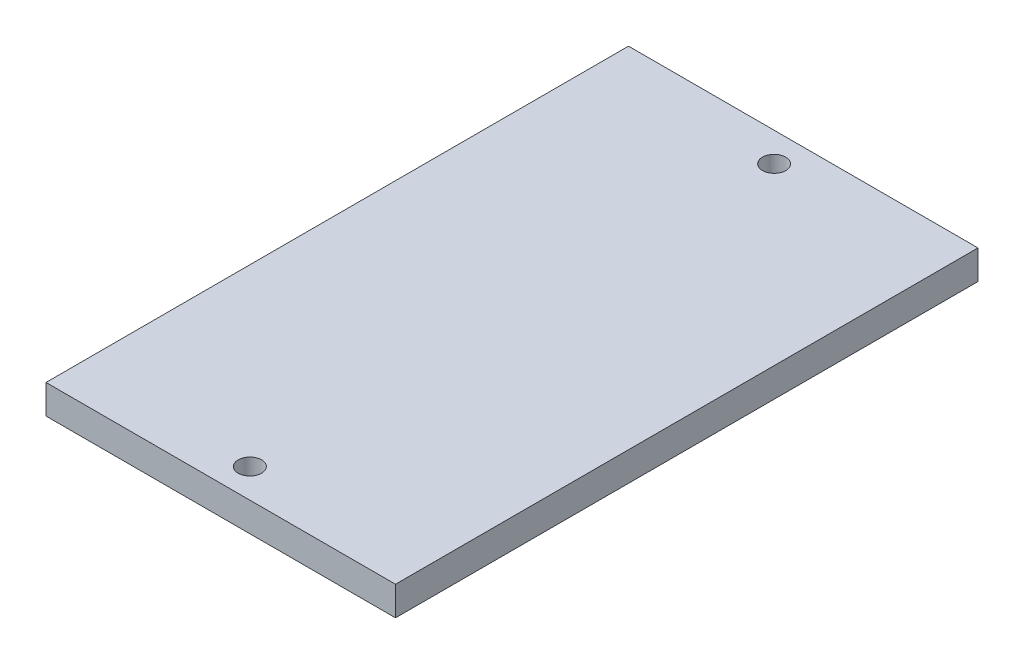
from build123d import *

# Parameters (mm, degrees)
SKETCH2_W           = 76.2
SKETCH2_H           = 127
BOSS_EXTRUDE1_DEPTH = 6.35
SKETCH6_R           = 2.54
CUT_EXTRUDE3_DEPTH  = 9.525


with BuildPart() as part:
    # Sketch2 → Boss-Extrude1 (new body)
    with BuildSketch(Plane(origin=(0, 0, 0), x_dir=(1, 0, 0), z_dir=(0, 1, 0))):
        with Locations((-1.871480339, 0)):
            Rectangle(SKETCH2_W, SKETCH2_H)
    extrude(amount=BOSS_EXTRUDE1_DEPTH)

    # Sketch6 → Cut-Extrude3 (cut)
    with BuildSketch(Plane(origin=(0, 6.35, 0), x_dir=(1, 0, 0), z_dir=(0, 1, 0))):
        with Locations(Location((-1.871480339, 57.15, 0), (0, 0, 270))):
            Circle(SKETCH6_R)
        with Locations(Location((-1.871480339, -57.15, 0), (0, 0, 270))):
            Circle(SKETCH6_R)
    extrude(amount=-CUT_EXTRUDE3_DEPTH, mode=Mode.SUBTRACT)


solid = part.part
